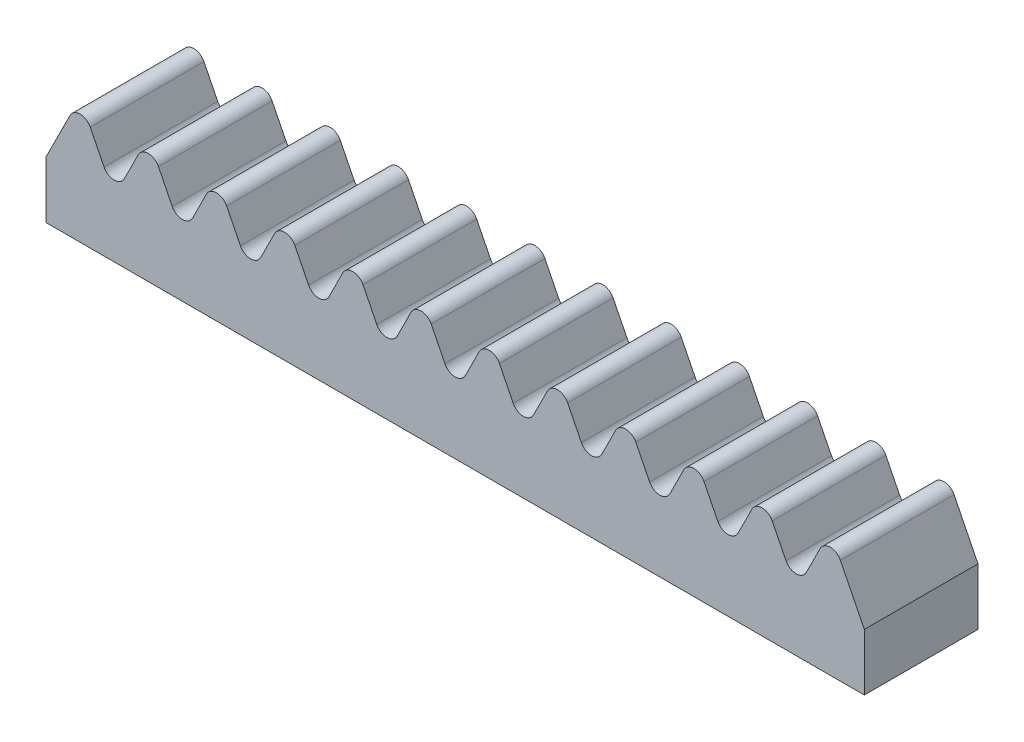
from build123d import *

# Parameters (mm, degrees)
BOSS_EXTRUDE1_DEPTH = 5


with BuildPart() as part:
    # Sketch2 → Boss-Extrude1 (new body)
    with BuildSketch(Plane.XY):
        with BuildLine():
            Line((-18, 0), (18, 0))
            Line((18, 0), (18, 2.5))
            Line((18, 2.5), (16.947213595, 4.605572809))
            ThreePointArc((16.947213595, 4.605572809), (16.5, 4.881966011), (16.052786405, 4.605572809))
            Line((16.052786405, 4.605572809), (15.447213595, 3.394427191))
            ThreePointArc((15.447213595, 3.394427191), (15, 3.118033989), (14.552786405, 3.394427191))
            Line((14.552786405, 3.394427191), (13.947213595, 4.605572809))
            ThreePointArc((13.947213595, 4.605572809), (13.5, 4.881966011), (13.052786405, 4.605572809))
            Line((13.052786405, 4.605572809), (12.447213595, 3.394427191))
            ThreePointArc((12.447213595, 3.394427191), (12, 3.118033989), (11.552786405, 3.394427191))
            Line((11.552786405, 3.394427191), (10.947213595, 4.605572809))
            ThreePointArc((10.947213595, 4.605572809), (10.5, 4.881966011), (10.052786405, 4.605572809))
            Line((10.052786405, 4.605572809), (9.447213595, 3.394427191))
            ThreePointArc((9.447213595, 3.394427191), (9, 3.118033989), (8.552786405, 3.394427191))
            Line((8.552786405, 3.394427191), (7.947213595, 4.605572809))
            ThreePointArc((7.947213595, 4.605572809), (7.5, 4.881966011), (7.052786405, 4.605572809))
            Line((7.052786405, 4.605572809), (6.447213595, 3.394427191))
            ThreePointArc((6.447213595, 3.394427191), (6, 3.118033989), (5.552786405, 3.394427191))
            Line((5.552786405, 3.394427191), (4.947213595, 4.605572809))
            ThreePointArc((4.947213595, 4.605572809), (4.5, 4.881966011), (4.052786405, 4.605572809))
            Line((4.052786405, 4.605572809), (3.447213595, 3.394427191))
            ThreePointArc((3.447213595, 3.394427191), (3, 3.118033989), (2.552786405, 3.394427191))
            Line((2.552786405, 3.394427191), (1.947213595, 4.605572809))
            ThreePointArc((1.947213595, 4.605572809), (1.5, 4.881966011), (1.052786405, 4.605572809))
            Line((1.052786405, 4.605572809), (0.447213595, 3.394427191))
            ThreePointArc((0.447213595, 3.394427191), (0, 3.118033989), (-0.447213595, 3.394427191))
            Line((-0.447213595, 3.394427191), (-1.052786405, 4.605572809))
            ThreePointArc((-1.052786405, 4.605572809), (-1.5, 4.881966011), (-1.947213595, 4.605572809))
            Line((-1.947213595, 4.605572809), (-2.552786405, 3.394427191))
            ThreePointArc((-2.552786405, 3.394427191), (-3, 3.118033989), (-3.447213595, 3.394427191))
            Line((-3.447213595, 3.394427191), (-4.052786405, 4.605572809))
            ThreePointArc((-4.052786405, 4.605572809), (-4.5, 4.881966011), (-4.947213595, 4.605572809))
            Line((-4.947213595, 4.605572809), (-5.552786405, 3.394427191))
            ThreePointArc((-5.552786405, 3.394427191), (-6, 3.118033989), (-6.447213595, 3.394427191))
            Line((-6.447213595, 3.394427191), (-7.052786405, 4.605572809))
            ThreePointArc((-7.052786405, 4.605572809), (-7.5, 4.881966011), (-7.947213595, 4.605572809))
            Line((-7.947213595, 4.605572809), (-8.552786405, 3.394427191))
            ThreePointArc((-8.552786405, 3.394427191), (-9, 3.118033989), (-9.447213595, 3.394427191))
            Line((-9.447213595, 3.394427191), (-10.052786405, 4.605572809))
            ThreePointArc((-10.052786405, 4.605572809), (-10.5, 4.881966011), (-10.947213595, 4.605572809))
            Line((-10.947213595, 4.605572809), (-11.552786405, 3.394427191))
            ThreePointArc((-11.552786405, 3.394427191), (-12, 3.118033989), (-12.447213595, 3.394427191))
            Line((-12.447213595, 3.394427191), (-13.052786405, 4.605572809))
            ThreePointArc((-13.052786405, 4.605572809), (-13.5, 4.881966011), (-13.947213595, 4.605572809))
            Line((-13.947213595, 4.605572809), (-14.552786405, 3.394427191))
            ThreePointArc((-14.552786405, 3.394427191), (-15, 3.118033989), (-15.447213595, 3.394427191))
            Line((-15.447213595, 3.394427191), (-16.052786405, 4.605572809))
            ThreePointArc((-16.052786405, 4.605572809), (-16.5, 4.881966011), (-16.947213595, 4.605572809))
            Line((-16.947213595, 4.605572809), (-18, 2.5))
            Line((-18, 2.5), (-18, 0))
        make_face()
    extrude(amount=BOSS_EXTRUDE1_DEPTH)


solid = part.part
